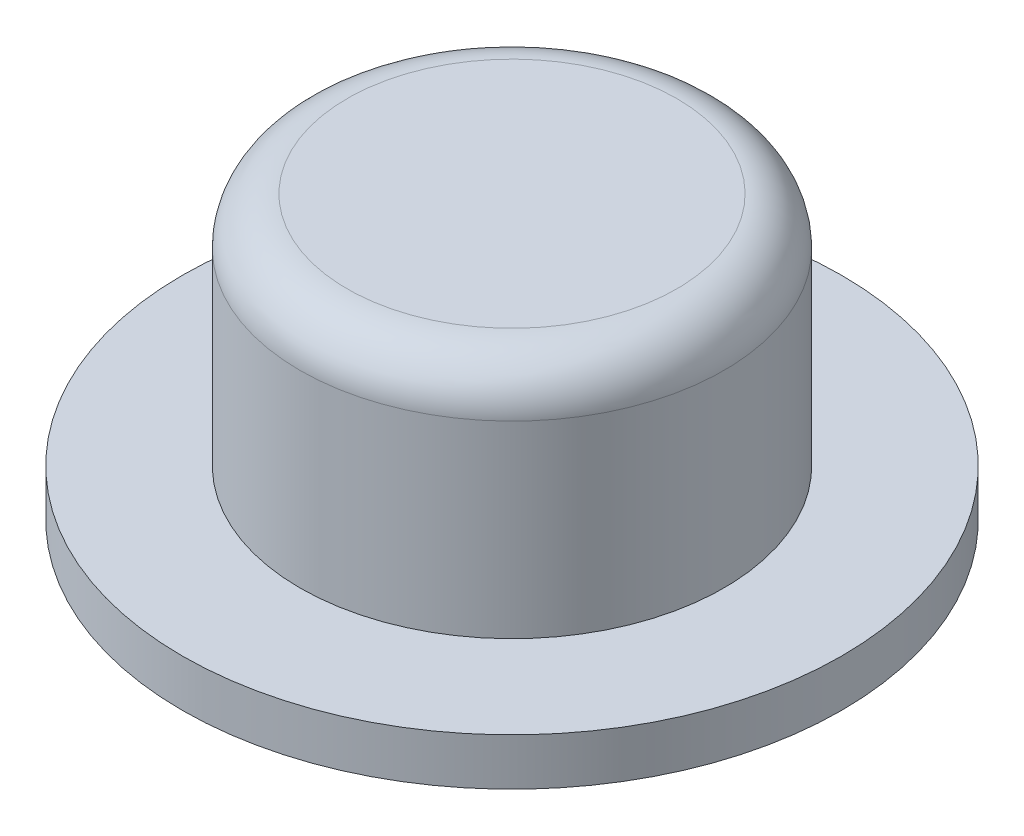
from build123d import *


with BuildPart() as part:
    # Sketch1 → Revolve1 (revolve)
    with BuildSketch(Plane.XY, mode=Mode.PRIVATE) as revolve1_sk:
        with BuildLine():
            Line((0, 6), (-3.5, 6))
            ThreePointArc((-3.5, 6), (-4.207106781, 5.707106781), (-4.5, 5))
            Line((-4.5, 5), (-4.5, 1))
            Line((-4.5, 1), (-7, 1))
            Line((-7, 1), (-7, 0))
            Line((-7, 0), (0, 0))
            Line((0, 0), (0, 6))
        make_face()
    revolve(revolve1_sk.sketch.rotate(Axis((0, 0, 0), (0, 1, 0)), 270), axis=Axis((0, 0, 0), (0, 1, 0)))


solid = part.part
